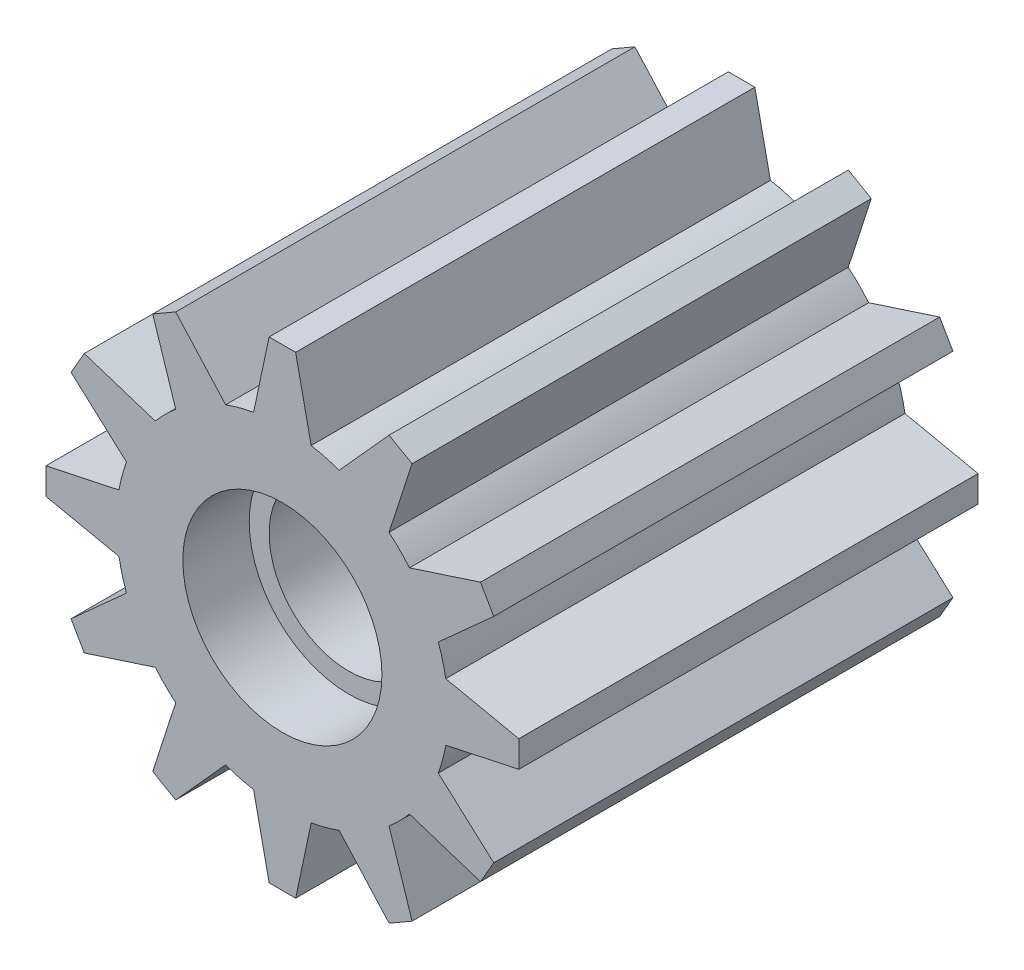
from build123d import *

# Parameters (mm, degrees)
ESQUISSE1_R                  = 12.5
BOSS_EXTRU_1_DEPTH           = 34.6
BOSS_EXTRU_2_START           = -34.6
BOSS_EXTRU_2_DEPTH           = 34.6
R_P_TITION_CIRCULAIRE1_COUNT = 12
ESQUISSE5_R                  = 7.5
ENL_V_MAT_EXTRU_2_DEPTH      = 5
ESQUISSE6_R                  = 6
ENL_V_MAT_EXTRU_3_DEPTH      = 24.6
ENL_V_START                  = -5
ESQUISSE7_R                  = 7.5
ENL_V_MAT_EXTRU_4_DEPTH      = 5


with BuildPart() as part:
    # Esquisse1 → Boss.-Extru.1 (new body)
    with BuildSketch(Plane.XY):
        Circle(ESQUISSE1_R)
    extrude(amount=BOSS_EXTRU_1_DEPTH)

    # Esquisse3 → Boss.-Extru.2 (add)
    with BuildSketch(Plane.XY.offset(34.6).offset(BOSS_EXTRU_2_START)):
        with BuildLine():
            Line((-1, 17.810368556), (-2.169061089, 12.310368556))
            ThreePointArc((-2.169061089, 12.310368556), (0, 12.5), (2.169061089, 12.310368556))
            Line((2.169061089, 12.310368556), (1, 17.810368556))
            Line((1, 17.810368556), (-1, 17.810368556))
        make_face()
    boss_extru_2 = extrude(amount=BOSS_EXTRU_2_DEPTH)

    # Répétition circulaire1: Boss.-Extru.2 ×12 about axis
    r_p_tition_circulaire1_axis = Axis((0, 0, 34.6), (0, 0, -1))
    for i in range(1, R_P_TITION_CIRCULAIRE1_COUNT):
        add(boss_extru_2.rotate(r_p_tition_circulaire1_axis, i * 360 / R_P_TITION_CIRCULAIRE1_COUNT))

    # Esquisse5 → Enlèv. mat.-Extru.2 (cut)
    with BuildSketch(Plane.XY.offset(34.6)):
        Circle(ESQUISSE5_R)
    extrude(amount=-ENL_V_MAT_EXTRU_2_DEPTH, mode=Mode.SUBTRACT)

    # Esquisse6 → Enlèv. mat.-Extru.3 (cut)
    with BuildSketch(Plane.XY.offset(29.6)):
        Circle(ESQUISSE6_R)
    extrude(amount=-ENL_V_MAT_EXTRU_3_DEPTH, mode=Mode.SUBTRACT)

    # Esquisse7 → Enlèv. mat.-Extru.4 (cut)
    with BuildSketch(Plane(origin=(0, 0, 0), x_dir=(-1, 0, 0), z_dir=(0, 0, -1)).offset(ENL_V_START)):
        Circle(ESQUISSE7_R)
    extrude(amount=ENL_V_MAT_EXTRU_4_DEPTH, mode=Mode.SUBTRACT)


solid = part.part
